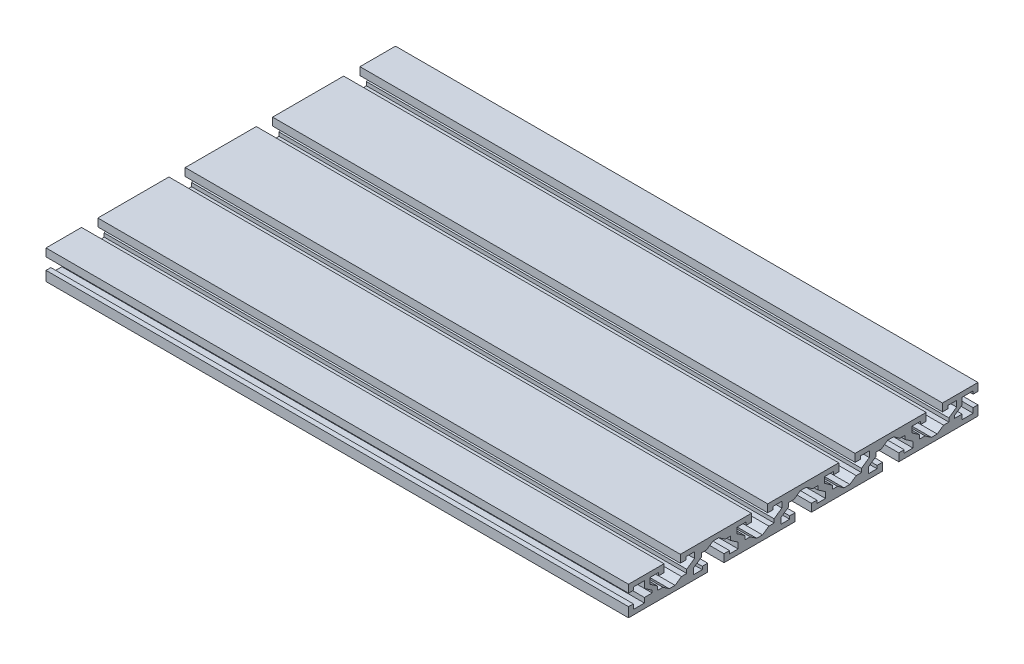
from build123d import *

# Parameters (mm, degrees)
SKETCH_1_W               = 300
SKETCH_1_H               = 180
EXTRUDE_1_DEPTH          = 15
CUT_EXTRUDE_1_DEPTH      = 176.570498661
CUT_EXTRUDE_1_DEPTH_BACK = 176.570498661
CUT_EXTRUDE_2_DEPTH      = 176.570498661
CUT_EXTRUDE_2_DEPTH_BACK = 176.570498661
CUT_EXTRUDE_3_DEPTH      = 176.570498661
CUT_EXTRUDE_3_DEPTH_BACK = 176.570498661


with BuildPart() as part:
    # Эскиз1 → Бобышка-Вытянуть1 (new body)
    with BuildSketch(Plane(origin=(0, 0, 0), x_dir=(1, 0, 0), z_dir=(0, 1, 0))):
        Rectangle(SKETCH_1_W, SKETCH_1_H)
    extrude(amount=EXTRUDE_1_DEPTH)

    # Эскиз3 → Вырез-Вытянуть1 (cut, two sides: drawn at the far end of the back side and taken through both)
    with BuildSketch(Plane(origin=(0, 0, 0), x_dir=(0, 0, -1), z_dir=(1, 0, 0)).offset(-CUT_EXTRUDE_1_DEPTH_BACK)):
        Polygon((-49.2, 0), (-40.8, 0), (-40.8, 4), (-38, 4), (-38, 2.5), (-33.5, 2.5), (-33.5, 5.5), (-37.5, 8.3), (-37.5, 10.2), (-40.214285714, 10.2), (-43.5, 12.5), (-46.5, 12.5), (-49.785714286, 10.2), (-52.5, 10.2), (-52.5, 8.3), (-56.5, 5.5), (-56.5, 2.5), (-52, 2.5), (-52, 4), (-49.2, 4), align=None)
        Polygon((-4.2, 0), (4.2, 0), (4.2, 4), (7, 4), (7, 2.5), (11.5, 2.5), (11.5, 5.5), (7.5, 8.3), (7.5, 10.2), (4.785714286, 10.2), (1.5, 12.5), (-1.5, 12.5), (-4.785714286, 10.2), (-7.5, 10.2), (-7.5, 8.3), (-11.5, 5.5), (-11.5, 2.5), (-7, 2.5), (-7, 4), (-4.2, 4), align=None)
        Polygon((40.8, 4), (40.8, 0), (49.2, 0), (49.2, 4), (52, 4), (52, 2.5), (56.5, 2.5), (56.5, 5.5), (52.5, 8.3), (52.5, 10.2), (49.785714286, 10.2), (46.5, 12.5), (43.5, 12.5), (40.214285714, 10.2), (37.5, 10.2), (37.5, 8.3), (33.5, 5.5), (33.5, 2.5), (38, 2.5), (38, 4), align=None)
    extrude(amount=CUT_EXTRUDE_1_DEPTH + CUT_EXTRUDE_1_DEPTH_BACK, mode=Mode.SUBTRACT)

    # Эскиз4 → Вырез-Вытянуть2 (cut, two sides: drawn at the far end of the back side and taken through both)
    with BuildSketch(Plane(origin=(0, 0, 0), x_dir=(0, 0, -1), z_dir=(1, 0, 0)).offset(-CUT_EXTRUDE_2_DEPTH_BACK)):
        Polygon((-71.7, 15), (-71.7, 11), (-74.5, 11), (-74.5, 12.5), (-79, 12.5), (-79, 9.5), (-75, 6.7), (-75, 4.8), (-72.285714286, 4.8), (-69, 2.5), (-66, 2.5), (-62.714285714, 4.8), (-60, 4.8), (-60, 6.7), (-56, 9.5), (-56, 12.5), (-60.5, 12.5), (-60.5, 11), (-63.3, 11), (-63.3, 15), align=None)
        Polygon((-18.3, 15), (-26.7, 15), (-26.7, 11), (-29.5, 11), (-29.5, 12.5), (-34, 12.5), (-34, 9.5), (-30, 6.7), (-30, 4.8), (-27.285714286, 4.8), (-24, 2.5), (-21, 2.5), (-17.714285714, 4.8), (-15, 4.8), (-15, 6.7), (-11, 9.5), (-11, 12.5), (-15.5, 12.5), (-15.5, 11), (-18.3, 11), align=None)
        Polygon((26.7, 15), (18.3, 15), (18.3, 11), (15.5, 11), (15.5, 12.5), (11, 12.5), (11, 9.5), (15, 6.7), (15, 4.8), (17.714285714, 4.8), (21, 2.5), (24, 2.5), (27.285714286, 4.8), (30, 4.8), (30, 6.7), (34, 9.5), (34, 12.5), (29.5, 12.5), (29.5, 11), (26.7, 11), align=None)
        Polygon((71.7, 15), (63.3, 15), (63.3, 11), (60.5, 11), (60.5, 12.5), (56, 12.5), (56, 9.5), (60, 6.7), (60, 4.8), (62.714285714, 4.8), (66, 2.5), (69, 2.5), (72.285714286, 4.8), (75, 4.8), (75, 6.7), (79, 9.5), (79, 12.5), (74.5, 12.5), (74.5, 11), (71.7, 11), align=None)
    extrude(amount=CUT_EXTRUDE_2_DEPTH + CUT_EXTRUDE_2_DEPTH_BACK, mode=Mode.SUBTRACT)

    # Эскиз5 → Вырез-Вытянуть3 (cut, two sides: drawn at the far end of the back side and taken through both)
    with BuildSketch(Plane(origin=(0, 0, 0), x_dir=(0, 0, -1), z_dir=(1, 0, 0)).offset(-CUT_EXTRUDE_3_DEPTH_BACK)):
        Polygon((-90, 11), (-90, 5), (-87.5, 5), (-87.5, 2.5), (-81.8, 2.5), (-81.8, 5), (-77.8, 5), (-77.8, 6.218688877), (-81.8, 9.018688877), (-81.8, 12.5), (-87.5, 12.5), (-87.5, 11), align=None)
        Polygon((90, 5), (90, 11), (87.5, 11), (87.5, 12.5), (81.8, 12.5), (81.8, 9.018688877), (77.8, 6.218688877), (77.8, 5), (81.8, 5), (81.8, 2.5), (87.5, 2.5), (87.5, 5), align=None)
    extrude(amount=CUT_EXTRUDE_3_DEPTH + CUT_EXTRUDE_3_DEPTH_BACK, mode=Mode.SUBTRACT)


solid = part.part
